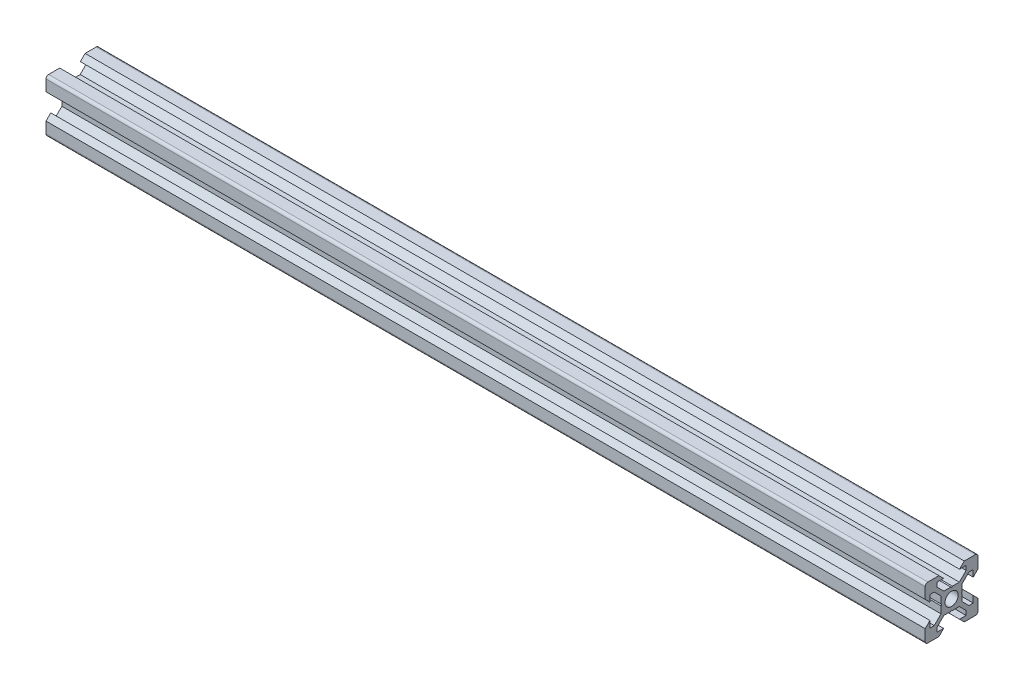
from build123d import *

# Parameters (mm, degrees)
SKETCH11_R                                    = 2.5
C_USERS_USER_GOOGLE_DRIVE_13_INFORMA_ES_DEPTH = 333


with BuildPart() as part:
    # Sketch11 → C_USERS_USER_GOOGLE DRIVE_13. INFORMA_ES (new body)
    with BuildSketch(Plane.YZ):
        with BuildLine():
            Line((-4.8, 10), (-3, 8.2))
            Line((-3, 8.2), (-5.5, 8.2))
            Line((-5.5, 8.2), (-5.5, 6.560660172))
            Line((-5.5, 6.560660172), (-2.939339828, 4))
            Line((-2.939339828, 4), (-0.3, 4))
            Line((-0.3, 4), (0, 3.7))
            Line((0, 3.7), (0.3, 4))
            Line((0.3, 4), (2.939339828, 4))
            Line((2.939339828, 4), (5.5, 6.560660172))
            Line((5.5, 6.560660172), (5.5, 8.2))
            Line((5.5, 8.2), (3, 8.2))
            Line((3, 8.2), (4.8, 10))
            Line((4.8, 10), (9, 10))
            ThreePointArc((9, 10), (9.707106781, 9.707106781), (10, 9))
            Line((10, 9), (10, 4.8))
            Line((10, 4.8), (8.2, 3))
            Line((8.2, 3), (8.2, 5.5))
            Line((8.2, 5.5), (6.560660172, 5.5))
            Line((6.560660172, 5.5), (4, 2.939339828))
            Line((4, 2.939339828), (4, 0.3))
            Line((4, 0.3), (3.7, 0))
            Line((3.7, 0), (4, -0.3))
            Line((4, -0.3), (4, -2.939339828))
            Line((4, -2.939339828), (6.560660172, -5.5))
            Line((6.560660172, -5.5), (8.2, -5.5))
            Line((8.2, -5.5), (8.2, -3))
            Line((8.2, -3), (10, -4.8))
            Line((10, -4.8), (10, -9))
            ThreePointArc((10, -9), (9.707106781, -9.707106781), (9, -10))
            Line((9, -10), (4.8, -10))
            Line((4.8, -10), (3, -8.2))
            Line((3, -8.2), (5.5, -8.2))
            Line((5.5, -8.2), (5.5, -6.560660172))
            Line((5.5, -6.560660172), (2.939339828, -4))
            Line((2.939339828, -4), (0.3, -4))
            Line((0.3, -4), (0, -3.7))
            Line((0, -3.7), (-0.3, -4))
            Line((-0.3, -4), (-2.939339828, -4))
            Line((-2.939339828, -4), (-5.5, -6.560660172))
            Line((-5.5, -6.560660172), (-5.5, -8.2))
            Line((-5.5, -8.2), (-3, -8.2))
            Line((-3, -8.2), (-4.8, -10))
            Line((-4.8, -10), (-9, -10))
            ThreePointArc((-9, -10), (-9.707106781, -9.707106781), (-10, -9))
            Line((-10, -9), (-10, -4.8))
            Line((-10, -4.8), (-8.2, -3))
            Line((-8.2, -3), (-8.2, -5.5))
            Line((-8.2, -5.5), (-6.560660172, -5.5))
            Line((-6.560660172, -5.5), (-4, -2.939339828))
            Line((-4, -2.939339828), (-4, -0.3))
            Line((-4, -0.3), (-3.7, 0))
            Line((-3.7, 0), (-4, 0.3))
            Line((-4, 0.3), (-4, 2.939339828))
            Line((-4, 2.939339828), (-6.560660172, 5.5))
            Line((-6.560660172, 5.5), (-8.2, 5.5))
            Line((-8.2, 5.5), (-8.2, 3))
            Line((-8.2, 3), (-10, 4.8))
            Line((-10, 4.8), (-10, 9))
            ThreePointArc((-10, 9), (-9.707106781, 9.707106781), (-9, 10))
            Line((-9, 10), (-4.8, 10))
        make_face()
        Circle(SKETCH11_R, mode=Mode.SUBTRACT)
    extrude(amount=C_USERS_USER_GOOGLE_DRIVE_13_INFORMA_ES_DEPTH)


solid = part.part
